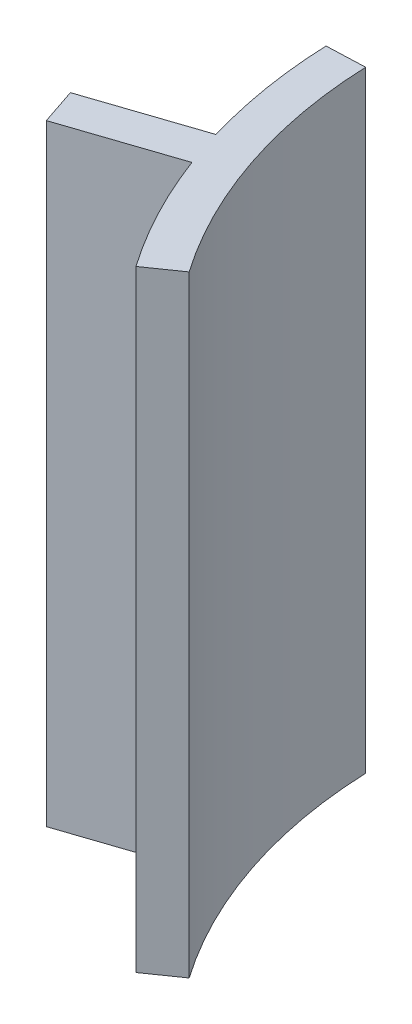
from build123d import *

# Parameters (mm, degrees)
BOSS_EXTRUDE1_DEPTH = 80


with BuildPart() as part:
    # Sketch1 → Boss-Extrude1 (new body)
    with BuildSketch(Plane(origin=(0, 0, 0), x_dir=(1, 0, 0), z_dir=(0, 1, 0))):
        with BuildLine():
            Line((-79.797325403, -29.387699101), (-65.53287479, -24.605737578))
            ThreePointArc((-65.53287479, -24.605737578), (-61.954038815, -32.583693383), (-57.408519486, -40.053238201))
            Line((-57.408519486, -40.053238201), (-53.307910951, -37.192292615))
            ThreePointArc((-53.307910951, -37.192292615), (-61.629140737, -20.660324585), (-64.953686456, -2.453286719))
            Line((-64.953686456, -2.453286719), (-69.950123876, -2.642001082))
            ThreePointArc((-69.950123876, -2.642001082), (-69.075024078, -11.342003731), (-67.122130527, -19.865034445))
            Line((-67.122130527, -19.865034445), (-81.386581141, -24.646995968))
            Line((-81.386581141, -24.646995968), (-79.797325403, -29.387699101))
        make_face()
    extrude(amount=BOSS_EXTRUDE1_DEPTH)


solid = part.part
